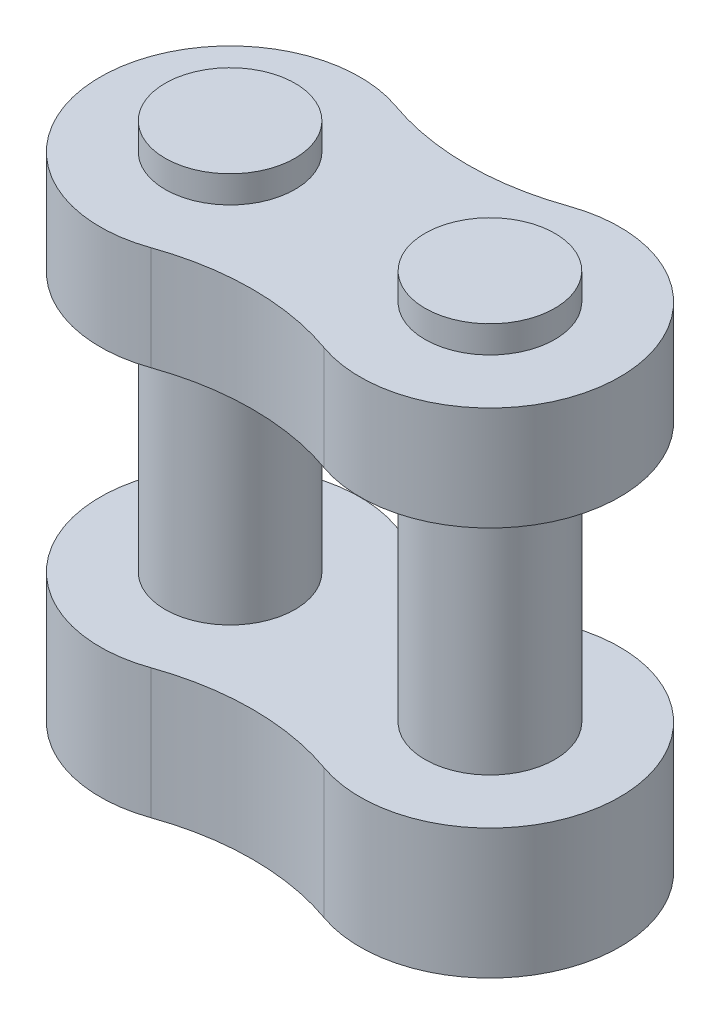
from build123d import *

# Parameters (mm, degrees)
SKETCH1_R                = 1.5875
BOSS_EXTRUDE1_DEPTH      = 2.54
BOSS_EXTRUDE2_DEPTH      = 3.2004
BOSS_EXTRUDE2_DEPTH_BACK = 6.35
SKETCH1_4_R              = 1.5875
BOSS_EXTRUDE3_DEPTH      = 3.175


with BuildPart() as part:
    # Sketch1 → Boss-Extrude1 (new body)
    with BuildSketch(Plane(origin=(0, 0, 0), x_dir=(1, 0, 0), z_dir=(0, 1, 0))):
        with BuildLine():
            ThreePointArc((-5.291666667, 2.993418707), (-9.525, 0), (-5.291666667, -2.993418707))
            ThreePointArc((-5.291666667, -2.993418707), (-3.175, -2.630256121), (-1.058333333, -2.993418707))
            ThreePointArc((-1.058333333, -2.993418707), (3.175, 0), (-1.058333333, 2.993418707))
            ThreePointArc((-1.058333333, 2.993418707), (-3.175, 2.630256121), (-5.291666667, 2.993418707))
        make_face()
        with Locations((-6.35, 0)):
            Circle(SKETCH1_R, mode=Mode.SUBTRACT)
        Circle(SKETCH1_R, mode=Mode.SUBTRACT)
    extrude(amount=BOSS_EXTRUDE1_DEPTH)

    # Sketch1<4> → Boss-Extrude2 (add, two sides: drawn at the far end of the back side and taken through both)
    with BuildSketch(Plane(origin=(0, 0, 0), x_dir=(1, 0, 0), z_dir=(0, 1, 0)).offset(-BOSS_EXTRUDE2_DEPTH_BACK)):
        with Locations((-6.35, 0)):
            Circle(SKETCH1_4_R)
        Circle(SKETCH1_4_R)
    extrude(amount=BOSS_EXTRUDE2_DEPTH + BOSS_EXTRUDE2_DEPTH_BACK)


with BuildPart() as body_2:
    # Sketch2 → Boss-Extrude3 (new body)
    with BuildSketch(Plane.XZ.offset(6.35)):
        with BuildLine():
            ThreePointArc((-5.291666667, 2.993418707), (-9.525, 0), (-5.291666667, -2.993418707))
            ThreePointArc((-5.291666667, -2.993418707), (-3.175, -2.630256121), (-1.058333333, -2.993418707))
            ThreePointArc((-1.058333333, -2.993418707), (3.175, 0), (-1.058333333, 2.993418707))
            ThreePointArc((-1.058333333, 2.993418707), (-3.175, 2.630256121), (-5.291666667, 2.993418707))
        make_face()
    extrude(amount=BOSS_EXTRUDE3_DEPTH)


solid = Compound([part.part, body_2.part])
